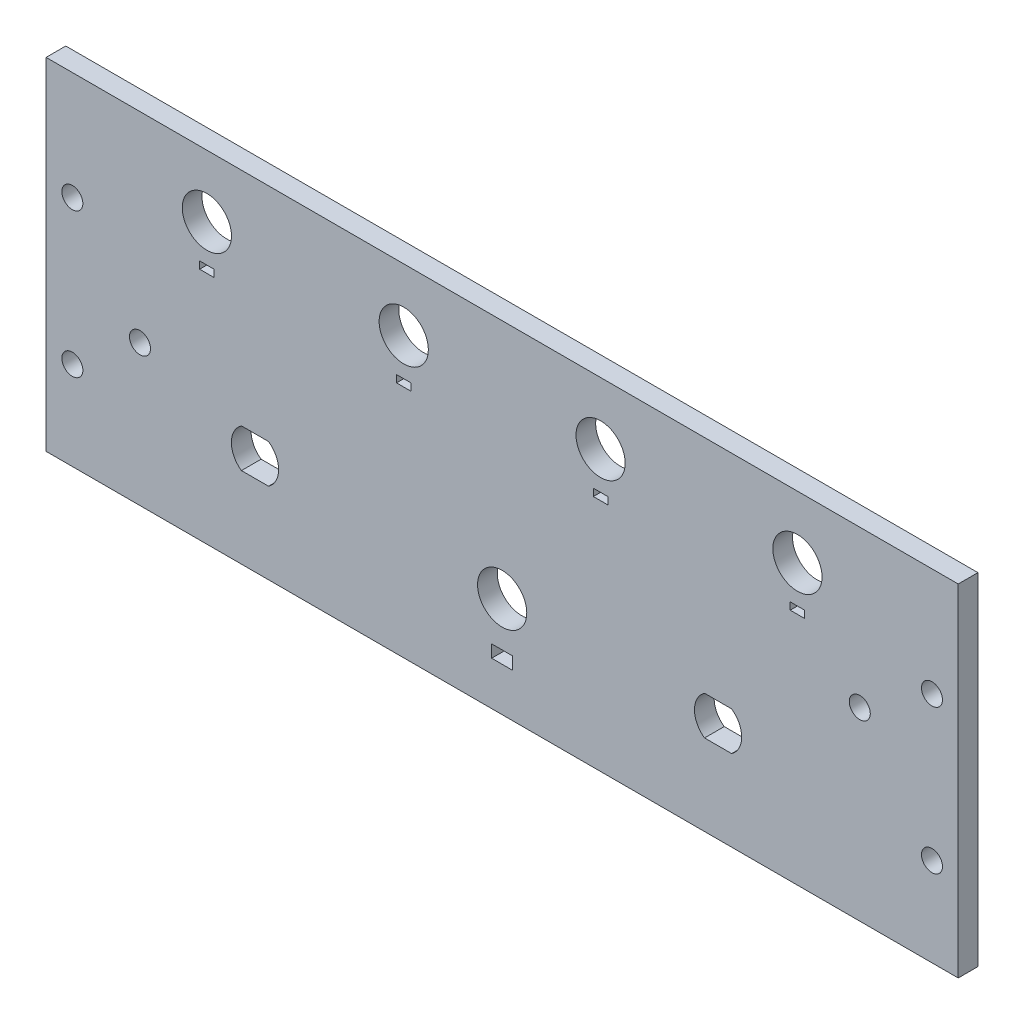
from build123d import *

# Parameters (mm, degrees)
SKETCH1_W           = 139
SKETCH1_H           = 52
SKETCH1_R           = 1.6
SKETCH1_R_2         = 3.75
SKETCH1_W_2         = 3.2
SKETCH1_H_2         = 1.9
SKETCH1_W_3         = 2.2
SKETCH1_H_3         = 1.1
BOSS_EXTRUDE1_DEPTH = 3


with BuildPart() as part:
    # Sketch1 → Boss-Extrude1 (new body)
    with BuildSketch(Plane.XY):
        with Locations((69.5, 26)):
            Rectangle(SKETCH1_W, SKETCH1_H)
        with Locations((4, 35.5)):
            Circle(SKETCH1_R, mode=Mode.SUBTRACT)
        with Locations((135, 35.5)):
            Circle(SKETCH1_R, mode=Mode.SUBTRACT)
        with Locations((135, 13.5)):
            Circle(SKETCH1_R, mode=Mode.SUBTRACT)
        with Locations((4, 13.5)):
            Circle(SKETCH1_R, mode=Mode.SUBTRACT)
        with Locations((14.309088021, 21.5)):
            Circle(SKETCH1_R, mode=Mode.SUBTRACT)
        with Locations((124, 28.19419762)):
            Circle(SKETCH1_R, mode=Mode.SUBTRACT)
        with Locations((69.5, 15.301613352)):
            Circle(SKETCH1_R_2, mode=Mode.SUBTRACT)
        with Locations((24.5, 42.541519479)):
            Circle(SKETCH1_R_2, mode=Mode.SUBTRACT)
        with Locations((54.5, 42.541519479)):
            Circle(SKETCH1_R_2, mode=Mode.SUBTRACT)
        with Locations((84.5, 42.541519479)):
            Circle(SKETCH1_R_2, mode=Mode.SUBTRACT)
        with Locations((114.5, 42.541519479)):
            Circle(SKETCH1_R_2, mode=Mode.SUBTRACT)
        with Locations((69.5, 7.601613352)):
            Rectangle(SKETCH1_W_2, SKETCH1_H_2, mode=Mode.SUBTRACT)
        with Locations((24.5, 36.291519479)):
            Rectangle(SKETCH1_W_3, SKETCH1_H_3, mode=Mode.SUBTRACT)
        with BuildLine():
            Line((100.339676821, 12.351613352), (104.466418878, 12.351613352))
            ThreePointArc((104.466418878, 12.351613352), (106.003047849, 15.301613352), (104.466418878, 18.251613352))
            Line((104.466418878, 18.251613352), (100.339676821, 18.251613352))
            ThreePointArc((100.339676821, 18.251613352), (98.803047849, 15.301613352), (100.339676821, 12.351613352))
        make_face(mode=Mode.SUBTRACT)
        with BuildLine():
            Line((29.767863143, 12.351613352), (33.894605199, 12.351613352))
            ThreePointArc((33.894605199, 12.351613352), (35.431234171, 15.301613352), (33.894605199, 18.251613352))
            Line((33.894605199, 18.251613352), (29.767863143, 18.251613352))
            ThreePointArc((29.767863143, 18.251613352), (28.231234171, 15.301613352), (29.767863143, 12.351613352))
        make_face(mode=Mode.SUBTRACT)
        with Locations((54.5, 36.291519479)):
            Rectangle(SKETCH1_W_3, SKETCH1_H_3, mode=Mode.SUBTRACT)
        with Locations((84.5, 36.291519479)):
            Rectangle(SKETCH1_W_3, SKETCH1_H_3, mode=Mode.SUBTRACT)
        with Locations((114.5, 36.291519479)):
            Rectangle(SKETCH1_W_3, SKETCH1_H_3, mode=Mode.SUBTRACT)
    extrude(amount=BOSS_EXTRUDE1_DEPTH)


solid = part.part
